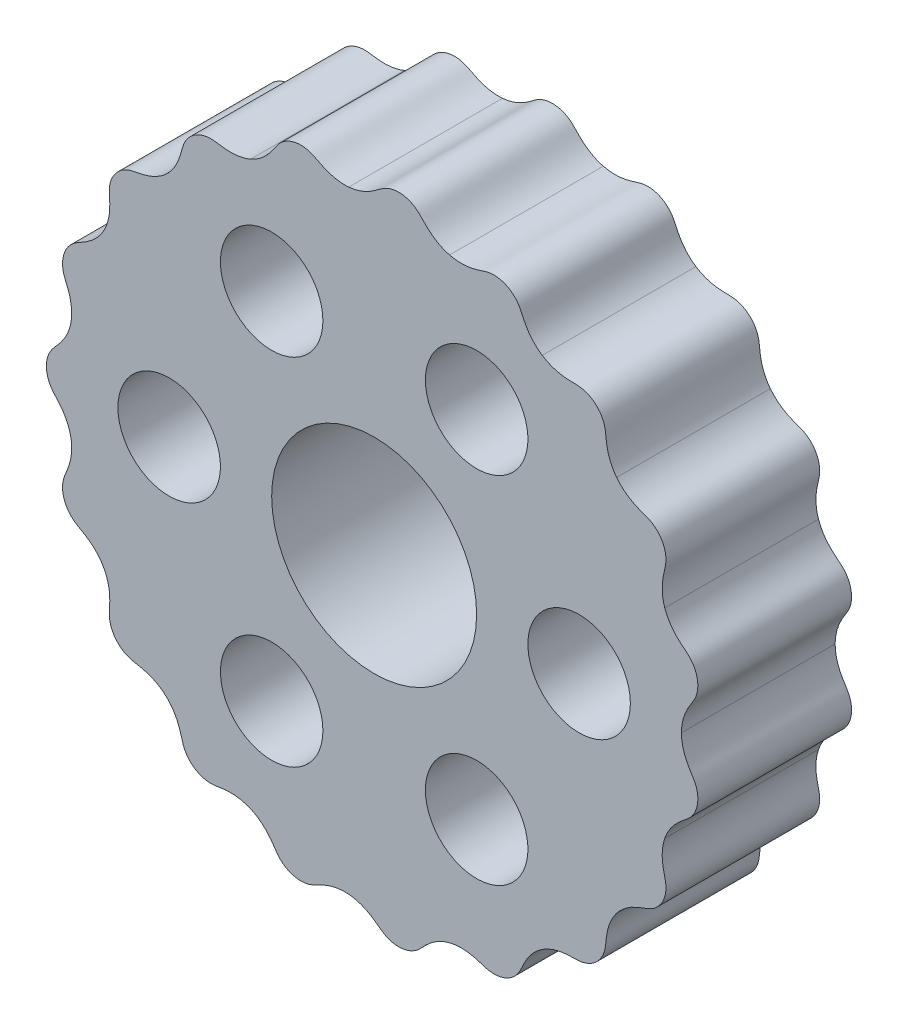
from build123d import *

# Parameters (mm, degrees)
DRIVER_R                    = 29.97999998
DRIVER_R_2                  = 10
EXTRUDE_1_DEPTH             = 7.5
EXTRUDE_2_REACH             = 1458.631
EXTRUDE_2_DIRECTION_2_REACH = 1458.631
PATTERN_CIRCULAR_3_COUNT    = 19
SKETCH_4_R                  = 5
CUT_EXTRUDE_5_DEPTH         = 1460.166884801
PATTERN_CIRCULAR_6_COUNT    = 6


with BuildPart() as part:
    # driver → 1 (new, symmetric)
    # profile 1 of 2: a face of its own
    with BuildSketch(Plane.XY):
        with Locations((1000, 1000)):
            Circle(DRIVER_R)
        with Locations((1000, 1000)):
            Circle(DRIVER_R_2, mode=Mode.SUBTRACT)
    # profile 2 of 2: a face of its own
    with BuildSketch(Plane.XY):
        with BuildLine():
            ThreePointArc((1028.355600887, 990.26550992), (1029.571111856, 995.065454187), (1029.97999998, 1000))
            Line((1029.97999998, 1000), (1028.355600906, 990.265509913))
        make_face()
    extrude(amount=EXTRUDE_1_DEPTH, both=True)

    # 2: up to this face of the body (flat: up to its plane)
    extrude_2_end = Plane(part.part.faces().sort_by_distance((970.867962472, 1000, 7.5))[0])
    # driver<3> → 2 (add, up to the picked face)
    with BuildSketch(Plane.XY, mode=Mode.PRIVATE) as extrude_2_sk1:
        with BuildLine():
            add(Edge.make_bspline(
                [(1029.98, 1000), (1029.979974915, 999.751123996), (1030.018161334, 999.279458078), (1030.168804318, 998.640803807), (1030.360390344, 998.125657468), (1030.549432605, 997.732152252), (1030.714445429, 997.436367505), (1030.850748311, 997.211171135), (1030.961633498, 997.034133219), (1031.052682131, 996.888704685), (1031.129213522, 996.763133212), (1031.195445014, 996.649121616), (1031.254383096, 996.540779593), (1031.307971831, 996.433905459), (1031.357303857, 996.325515258), (1031.402823808, 996.213535918), (1031.444503883, 996.096601981), (1031.481989425, 995.973916232), (1031.514717997, 995.845149266), (1031.542016383, 995.710362463), (1031.563179453, 995.569944841), (1031.577533875, 995.42455792), (1031.584488892, 995.275085091), (1031.583575711, 995.12258344), (1031.57447655, 994.968236937), (1031.557044075, 994.813310505), (1031.531311709, 994.659104891), (1031.497495114, 994.506912485), (1031.45598503, 994.357974408), (1031.407331527, 994.213439208), (1031.352219604, 994.07432352), (1031.291435889, 993.941474936), (1031.225825965, 993.815537166), (1031.156241477, 993.696917256), (1031.083475664, 993.585754188), (1031.008185194, 993.481887428), (1030.930795073, 993.384822792), (1030.851381886, 993.293691106), (1030.769528565, 993.207191867), (1030.684141441, 993.123508703), (1030.59321819, 993.040174112), (1030.493555798, 992.95384531), (1030.380398098, 992.859927347), (1030.247062163, 992.751941976), (1030.084700924, 992.620500824), (1029.882662166, 992.451763687), (1029.630549042, 992.22558495), (1029.323978678, 991.914782854), (1028.975505568, 991.489756446), (1028.625654134, 990.934619921), (1028.436387087, 990.500909274), (1028.355600906, 990.265509913)],
                knots=[0.100713896, 0.100713896, 0.100713896, 0.100713896, 0.153859863, 0.201427793, 0.240527516, 0.271124429, 0.294664828, 0.312906176, 0.32739104, 0.339320774, 0.349584548, 0.358825698, 0.367504254, 0.375945924, 0.384378032, 0.392955304, 0.401778294, 0.410906649, 0.420368777, 0.430169005, 0.440292989, 0.450711894, 0.461385697, 0.472265885, 0.483297716, 0.494422188, 0.505577812, 0.516702284, 0.527734115, 0.538614303, 0.549288106, 0.559707011, 0.569830995, 0.579631223, 0.589093351, 0.598221706, 0.607044696, 0.615621968, 0.624054076, 0.632495746, 0.641174302, 0.650415452, 0.660679226, 0.67260896, 0.687093824, 0.705335172, 0.728875571, 0.759472484, 0.798572207, 0.846140137, 0.899286104, 0.899286104, 0.899286104, 0.899286104], degree=3))
            ThreePointArc((1029.97999998, 1000), (1029.571111856, 995.065454187), (1028.355600887, 990.26550992))
        make_face()
    extrude_2_tool1 = split(extrude(extrude_2_sk1.sketch, amount=EXTRUDE_2_REACH, mode=Mode.PRIVATE), bisect_by=extrude_2_end, keep=Keep.BOTH, mode=Mode.PRIVATE)
    # driver<3> → 2 (add, up to the picked face)
    with BuildSketch(Plane.XY, mode=Mode.PRIVATE) as extrude_2_sk2:
        with BuildLine():
            ThreePointArc((1028.355600887, 990.26550992), (1029.571111856, 995.065454187), (1029.97999998, 1000))
            Line((1029.97999998, 1000), (1028.355600906, 990.265509913))
        make_face()
    extrude_2_tool2 = split(extrude(extrude_2_sk2.sketch, amount=EXTRUDE_2_REACH, mode=Mode.PRIVATE), bisect_by=extrude_2_end, keep=Keep.BOTH, mode=Mode.PRIVATE)
    extrude_2_1 = extrude_2_tool1.solids().sort_by(Axis((1030.279839, 994.947194, 0), (0, 0, 1)))[0]
    add(extrude_2_1)
    extrude_2_2 = extrude_2_tool2.solids().sort_by(Axis((1029.32922, 995.105819, 0), (0, 0, 1)))[0]
    add(extrude_2_2)
    extrude_2 = extrude_2_1 + extrude_2_2  # 2 as one shape, for the pattern or mirror that repeats it

    # 2 direction 2: up to this face of the body (flat: up to its plane)
    extrude_2_direction_2_end = Plane(part.part.faces().sort_by_distance((970.867962472, 1000, -7.5))[0])
    # driver<3> → 2 direction 2 (add, up to the picked face)
    with BuildSketch(Plane.XY, mode=Mode.PRIVATE) as extrude_2_direction_2_sk1:
        with BuildLine():
            add(Edge.make_bspline(
                [(1029.98, 1000), (1029.979974915, 999.751123996), (1030.018161334, 999.279458078), (1030.168804318, 998.640803807), (1030.360390344, 998.125657468), (1030.549432605, 997.732152252), (1030.714445429, 997.436367505), (1030.850748311, 997.211171135), (1030.961633498, 997.034133219), (1031.052682131, 996.888704685), (1031.129213522, 996.763133212), (1031.195445014, 996.649121616), (1031.254383096, 996.540779593), (1031.307971831, 996.433905459), (1031.357303857, 996.325515258), (1031.402823808, 996.213535918), (1031.444503883, 996.096601981), (1031.481989425, 995.973916232), (1031.514717997, 995.845149266), (1031.542016383, 995.710362463), (1031.563179453, 995.569944841), (1031.577533875, 995.42455792), (1031.584488892, 995.275085091), (1031.583575711, 995.12258344), (1031.57447655, 994.968236937), (1031.557044075, 994.813310505), (1031.531311709, 994.659104891), (1031.497495114, 994.506912485), (1031.45598503, 994.357974408), (1031.407331527, 994.213439208), (1031.352219604, 994.07432352), (1031.291435889, 993.941474936), (1031.225825965, 993.815537166), (1031.156241477, 993.696917256), (1031.083475664, 993.585754188), (1031.008185194, 993.481887428), (1030.930795073, 993.384822792), (1030.851381886, 993.293691106), (1030.769528565, 993.207191867), (1030.684141441, 993.123508703), (1030.59321819, 993.040174112), (1030.493555798, 992.95384531), (1030.380398098, 992.859927347), (1030.247062163, 992.751941976), (1030.084700924, 992.620500824), (1029.882662166, 992.451763687), (1029.630549042, 992.22558495), (1029.323978678, 991.914782854), (1028.975505568, 991.489756446), (1028.625654134, 990.934619921), (1028.436387087, 990.500909274), (1028.355600906, 990.265509913)],
                knots=[0.100713896, 0.100713896, 0.100713896, 0.100713896, 0.153859863, 0.201427793, 0.240527516, 0.271124429, 0.294664828, 0.312906176, 0.32739104, 0.339320774, 0.349584548, 0.358825698, 0.367504254, 0.375945924, 0.384378032, 0.392955304, 0.401778294, 0.410906649, 0.420368777, 0.430169005, 0.440292989, 0.450711894, 0.461385697, 0.472265885, 0.483297716, 0.494422188, 0.505577812, 0.516702284, 0.527734115, 0.538614303, 0.549288106, 0.559707011, 0.569830995, 0.579631223, 0.589093351, 0.598221706, 0.607044696, 0.615621968, 0.624054076, 0.632495746, 0.641174302, 0.650415452, 0.660679226, 0.67260896, 0.687093824, 0.705335172, 0.728875571, 0.759472484, 0.798572207, 0.846140137, 0.899286104, 0.899286104, 0.899286104, 0.899286104], degree=3))
            ThreePointArc((1029.97999998, 1000), (1029.571111856, 995.065454187), (1028.355600887, 990.26550992))
        make_face()
    extrude_2_direction_2_tool1 = split(extrude(extrude_2_direction_2_sk1.sketch, amount=-EXTRUDE_2_DIRECTION_2_REACH, mode=Mode.PRIVATE), bisect_by=extrude_2_direction_2_end, keep=Keep.BOTH, mode=Mode.PRIVATE)
    # driver<3> → 2 direction 2 (add, up to the picked face)
    with BuildSketch(Plane.XY, mode=Mode.PRIVATE) as extrude_2_direction_2_sk2:
        with BuildLine():
            ThreePointArc((1028.355600887, 990.26550992), (1029.571111856, 995.065454187), (1029.97999998, 1000))
            Line((1029.97999998, 1000), (1028.355600906, 990.265509913))
        make_face()
    extrude_2_direction_2_tool2 = split(extrude(extrude_2_direction_2_sk2.sketch, amount=-EXTRUDE_2_DIRECTION_2_REACH, mode=Mode.PRIVATE), bisect_by=extrude_2_direction_2_end, keep=Keep.BOTH, mode=Mode.PRIVATE)
    extrude_2_direction_2_1 = extrude_2_direction_2_tool1.solids().sort_by(Axis((1030.279839, 994.947194, 0), (0, 0, -1)))[0]
    add(extrude_2_direction_2_1)
    extrude_2_direction_2_2 = extrude_2_direction_2_tool2.solids().sort_by(Axis((1029.32922, 995.105819, 0), (0, 0, -1)))[0]
    add(extrude_2_direction_2_2)
    extrude_2_direction_2 = extrude_2_direction_2_1 + extrude_2_direction_2_2  # 2 direction 2 as one shape, for the pattern or mirror that repeats it

    # 3: 2, 2 direction 2 ×19 about axis
    pattern_circular_3_axis = Axis((1000, 1000, 7.5), (0, 0, -1))
    add([extrude_2.rotate(pattern_circular_3_axis, i * 360 / PATTERN_CIRCULAR_3_COUNT) for i in range(1, PATTERN_CIRCULAR_3_COUNT)])
    add([extrude_2_direction_2.rotate(pattern_circular_3_axis, i * 360 / PATTERN_CIRCULAR_3_COUNT) for i in range(1, PATTERN_CIRCULAR_3_COUNT)])

    # 4 → 5 (cut, through all)
    with BuildSketch(Plane.XY.offset(7.5)):
        with Locations((1020, 1000)):
            Circle(SKETCH_4_R)
    cut_extrude_5 = extrude(amount=-CUT_EXTRUDE_5_DEPTH, mode=Mode.SUBTRACT)

    # 6: 5 ×6 about axis
    pattern_circular_6_axis = Axis((1000, 1000, 0), (0, 0, 1))
    for i in range(1, PATTERN_CIRCULAR_6_COUNT):
        add(cut_extrude_5.rotate(pattern_circular_6_axis, i * 360 / PATTERN_CIRCULAR_6_COUNT), mode=Mode.SUBTRACT)


solid = part.part
